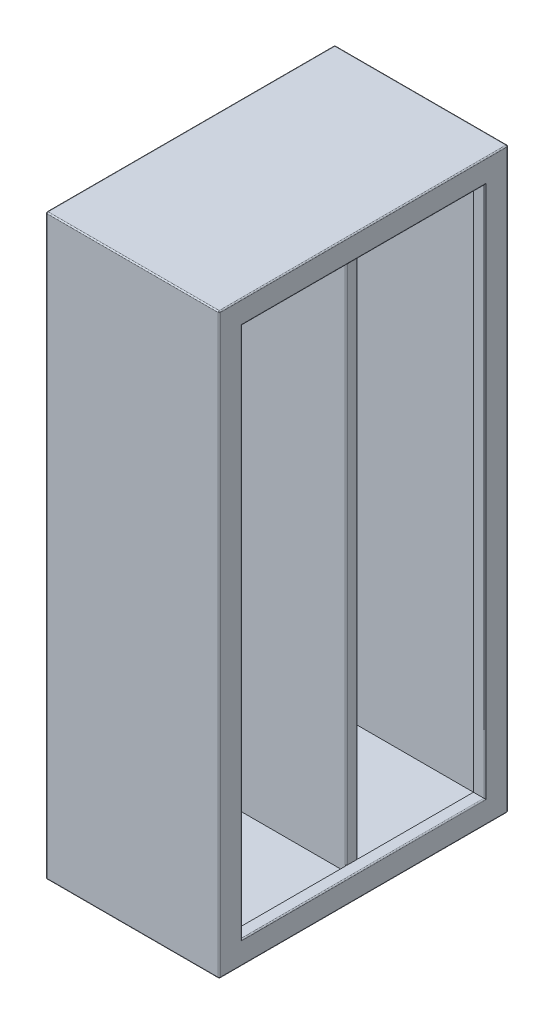
from build123d import *

# Parameters (mm, degrees)
SKETCH1_W           = 1000
SKETCH1_H           = 300
BOSS_EXTRUDE1_DEPTH = 500
SHELL1_T            = -40
SKETCH3_W           = 940
SKETCH3_H           = 440
CUT_EXTRUDE1_DEPTH  = 240
SKETCH4_W           = 940
SKETCH4_H           = 20
BOSS_EXTRUDE2_DEPTH = 240
FILLET1_R           = 2


with BuildPart() as part:
    # Sketch1 → Boss-Extrude1 (new body)
    with BuildSketch(Plane(origin=(0, 0, 0), x_dir=(0, 1, 0), z_dir=(0, 0, 1))):
        with Locations((0, -150)):
            Rectangle(SKETCH1_W, SKETCH1_H)
    extrude(amount=BOSS_EXTRUDE1_DEPTH)

    # Shell1
    shell1_openings = [part.faces().sort_by_distance(p)[0] for p in [
        (300, 0, 250),
    ]]
    offset(amount=SHELL1_T, openings=shell1_openings, kind=Kind.INTERSECTION)

    # Sketch3 → Cut-Extrude1 (cut)
    with BuildSketch(Plane.YZ.offset(40)):
        with Locations((0, 250)):
            Rectangle(SKETCH3_W, SKETCH3_H)
    extrude(amount=CUT_EXTRUDE1_DEPTH, mode=Mode.SUBTRACT)

    # Sketch4 → Boss-Extrude2 (add)
    with BuildSketch(Plane.YZ.offset(40)):
        with Locations((0, 250)):
            Rectangle(SKETCH4_W, SKETCH4_H)
    extrude(amount=BOSS_EXTRUDE2_DEPTH)

    # Fillet1
    fillet1_edges = [part.edges().sort_by_distance(p)[0] for p in [
        (150, 500, 500),
        (300, 0, 40),
        (300, -460, 250),
        (0, 0, 500),
        (300, 460, 250),
        (300, 0, 460),
        (150, -500, 500),
        (0, 0, 0),
        (150, 500, 0),
        (280, 0, 240),
        (280, 0, 260),
        (300, 0, 0),
        (150, -500, 0),
        (0, -500, 250),
        (0, 500, 250),
        (300, 500, 250),
        (300, -500, 250),
        (300, 0, 500),
    ]]
    fillet(fillet1_edges, radius=FILLET1_R)


solid = part.part
